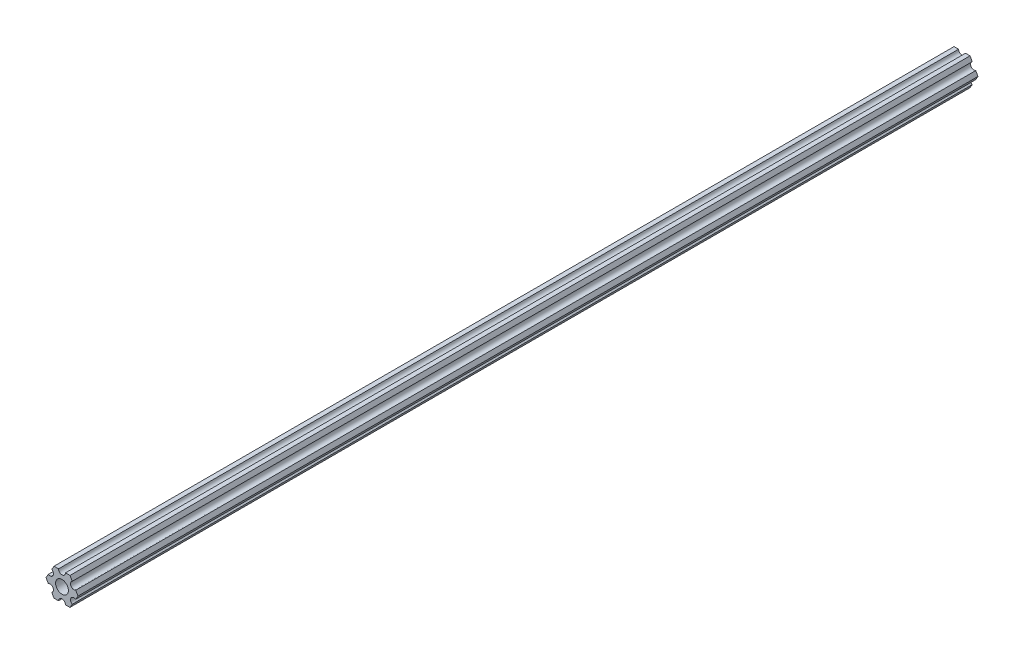
from build123d import *

# Parameters (mm, degrees)
SKETCH1_R           = 2.9337
BOSS_EXTRUDE1_DEPTH = 412.75


with BuildPart() as part:
    # Sketch1 → Boss-Extrude1 (new body)
    with BuildSketch(Plane.XY):
        with BuildLine():
            Line((-1.587500385, 6.349999904), (-3.666174594, 6.349999778))
            Line((-3.666174594, 6.349999778), (-4.70551159, 4.549815043))
            ThreePointArc((-4.70551159, 4.549815043), (-4.12444613, 2.38124975), (-6.293011423, 1.80018429))
            Line((-6.293011423, 1.80018429), (-7.332348419, -4.44e-07))
            Line((-7.332348419, -4.44e-07), (-6.293011205, -1.800185053))
            ThreePointArc((-6.293011205, -1.800185053), (-4.124445841, -2.38125025), (-4.705511038, -4.549815614))
            Line((-4.705511038, -4.549815614), (-3.666173825, -6.350000222))
            Line((-3.666173825, -6.350000222), (-1.587499615, -6.350000096))
            ThreePointArc((-1.587499615, -6.350000096), (2.89e-07, -4.7625), (1.587500385, -6.349999904))
            Line((1.587500385, -6.349999904), (3.666174594, -6.349999778))
            Line((3.666174594, -6.349999778), (4.70551159, -4.549815043))
            ThreePointArc((4.70551159, -4.549815043), (4.12444613, -2.38124975), (6.293011423, -1.80018429))
            Line((6.293011423, -1.80018429), (7.332348419, 4.44e-07))
            Line((7.332348419, 4.44e-07), (6.293011205, 1.800185053))
            ThreePointArc((6.293011205, 1.800185053), (4.124445841, 2.38125025), (4.705511038, 4.549815614))
            Line((4.705511038, 4.549815614), (3.666173825, 6.350000222))
            Line((3.666173825, 6.350000222), (1.587499615, 6.350000096))
            ThreePointArc((1.587499615, 6.350000096), (-2.89e-07, 4.7625), (-1.587500385, 6.349999904))
        make_face()
        Circle(SKETCH1_R, mode=Mode.SUBTRACT)
    extrude(amount=BOSS_EXTRUDE1_DEPTH)


solid = part.part
